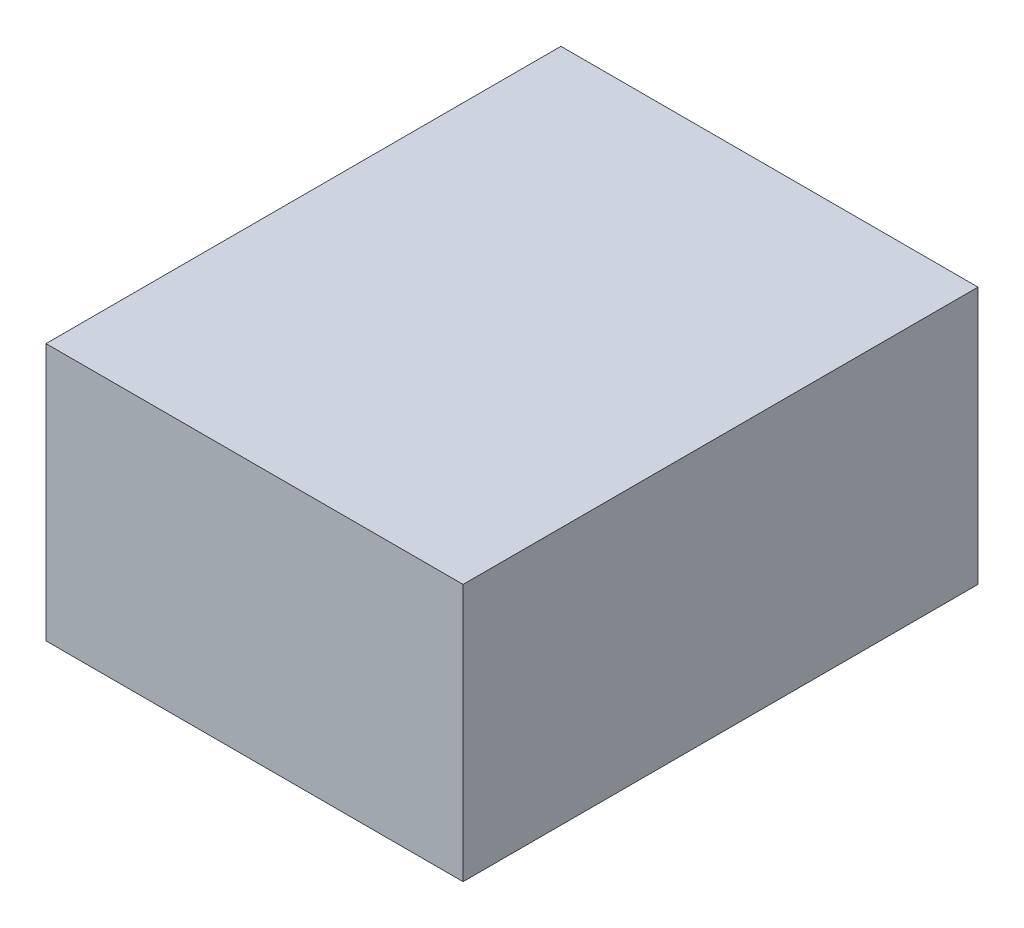
from build123d import *

# Parameters (mm, degrees)
SKETCH1_W           = 16.2
SKETCH1_H           = 20
BOSS_EXTRUDE1_DEPTH = 10


with BuildPart() as part:
    # Sketch1 → Boss-Extrude1 (new body)
    with BuildSketch(Plane(origin=(0, 0, 0), x_dir=(1, 0, 0), z_dir=(0, 1, 0))):
        with Locations((8.1, 10)):
            Rectangle(SKETCH1_W, SKETCH1_H)
    extrude(amount=BOSS_EXTRUDE1_DEPTH)


solid = part.part
